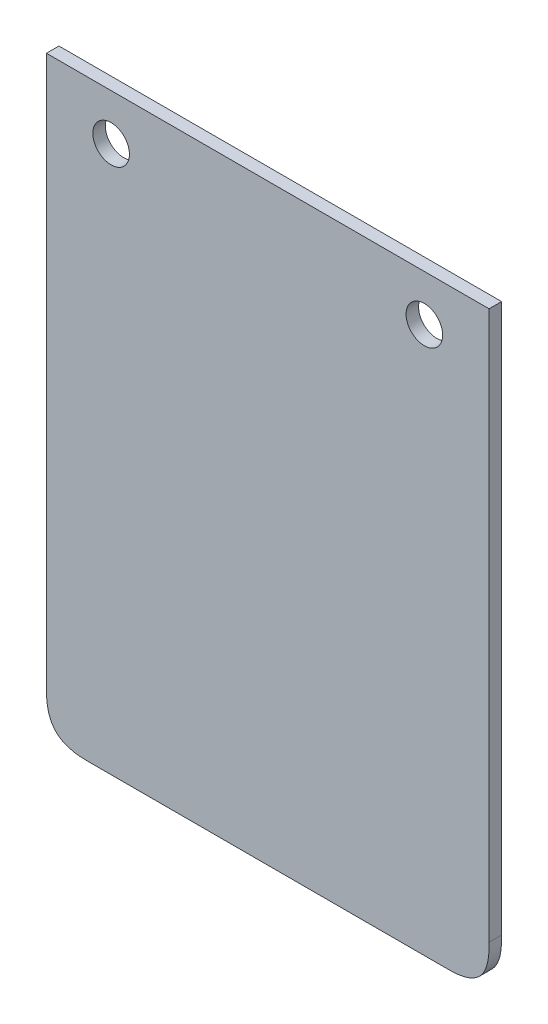
from build123d import *

# Parameters (mm, degrees)
EXTRUDE_1_DEPTH     = 1
SKETCH_3_R          = 1.461309726
CUT_EXTRUDE_1_DEPTH = 30.539473805
SKETCH_4_R          = 1.461309726
CUT_EXTRUDE_2_DEPTH = 30.539473805


with BuildPart() as part:
    # 草图1 → 凸台-拉伸1 (new body)
    with BuildSketch(Plane.XY):
        with BuildLine():
            Line((-14.169164627, -23.65123941), (14.169164627, -23.65123941))
            add(Edge.make_bspline(
                [(14.169164627, -23.65123941), (14.641115694, -23.65123941), (14.895621691, -23.634812103), (15.286929381, -23.609554813), (15.614593008, -23.536727458), (16.423695213, -23.356894333), (16.897637323, -22.885072298), (17.371826501, -22.4130043), (17.553529452, -21.601702104), (17.626757355, -21.274740113), (17.652443906, -20.882211126), (17.669164627, -20.626693451), (17.669164627, -20.15123941)],
                knots=[0, 0, 0, 0.125, 0.125, 0.25, 0.25, 0.5, 0.5, 0.75, 0.75, 0.875, 0.875, 1, 1, 1], degree=2))
            Line((17.669164627, -20.15123941), (17.669164627, 23.65123941))
            Line((17.669164627, 23.65123941), (-17.669164627, 23.65123941))
            Line((-17.669164627, 23.65123941), (-17.669164627, -20.15123941))
            add(Edge.make_bspline(
                [(-17.669164627, -20.15123941), (-17.669164627, -20.623190478), (-17.652737319, -20.877696475), (-17.62748003, -21.269004165), (-17.554652675, -21.596667791), (-17.37481955, -22.405769996), (-16.902997515, -22.879712106), (-16.430929517, -23.353901285), (-15.619627321, -23.535604236), (-15.29266533, -23.608832139), (-14.900136342, -23.634518689), (-14.644618668, -23.65123941), (-14.169164627, -23.65123941)],
                knots=[0, 0, 0, 0.125, 0.125, 0.25, 0.25, 0.5, 0.5, 0.75, 0.75, 0.875, 0.875, 1, 1, 1], degree=2))
        make_face()
    extrude(amount=EXTRUDE_1_DEPTH)

    # 草图3 → 切除-拉伸1 (cut, through all)
    with BuildSketch(Plane.XY.offset(1)):
        with Locations((-12.503417236, 19.975)):
            Circle(SKETCH_3_R)
    extrude(amount=-CUT_EXTRUDE_1_DEPTH, mode=Mode.SUBTRACT)

    # 草图4 → 切除-拉伸2 (cut, through all)
    with BuildSketch(Plane.XY.offset(1)):
        with Locations((12.503417236, 19.975)):
            Circle(SKETCH_4_R)
    extrude(amount=-CUT_EXTRUDE_2_DEPTH, mode=Mode.SUBTRACT)


solid = part.part
